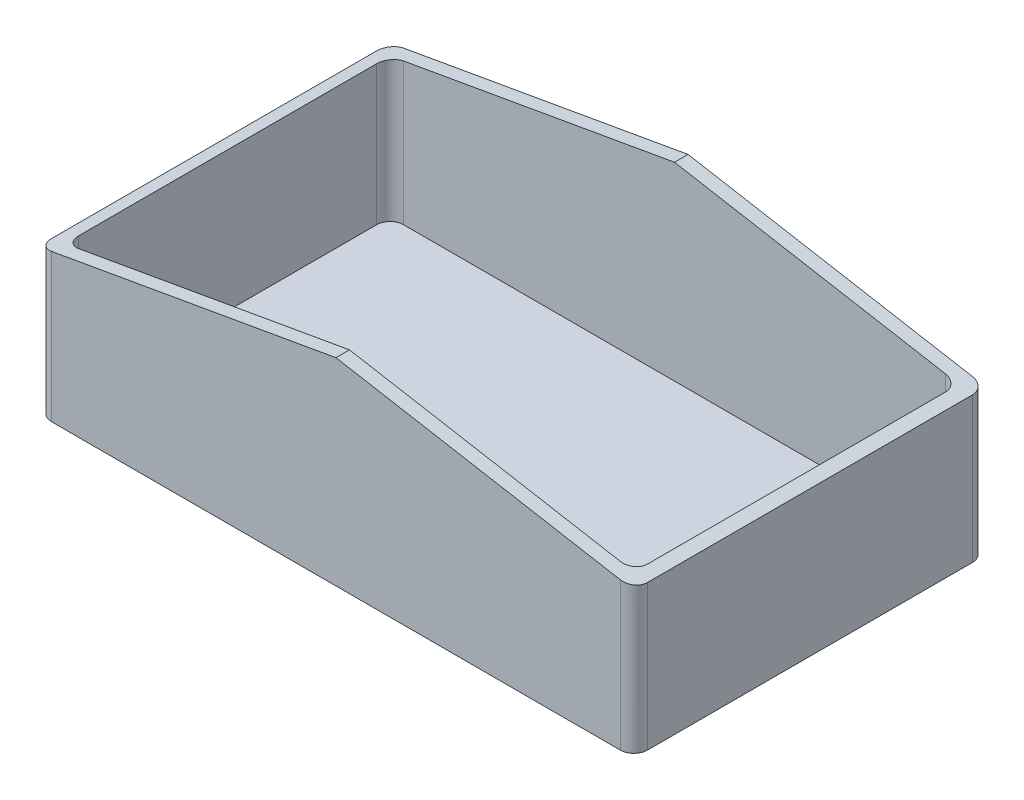
from build123d import *

# Parameters (mm, degrees)
EXTRUDE_1_DEPTH     = 30
EXTRUDE_2_DEPTH     = 700
CUT_EXTRUDE_1_REACH = 1854.809


with BuildPart() as part:
    # Эскиз1 → Бобышка-Вытянуть1 (new body)
    with BuildSketch(Plane(origin=(0, 0, 0), x_dir=(1, 0, 0), z_dir=(0, 1, 0))):
        with BuildLine():
            Line((-1050, -650), (1050, -650))
            ThreePointArc((1050, -650), (1085.355339059, -635.355339059), (1100, -600))
            Line((1100, -600), (1100, 600))
            ThreePointArc((1100, 600), (1085.355339059, 635.355339059), (1050, 650))
            Line((1050, 650), (-1050, 650))
            ThreePointArc((-1050, 650), (-1085.355339059, 635.355339059), (-1100, 600))
            Line((-1100, 600), (-1100, -600))
            ThreePointArc((-1100, -600), (-1085.355339059, -635.355339059), (-1050, -650))
        make_face()
    extrude(amount=EXTRUDE_1_DEPTH)

    # Эскиз2 → Бобышка-Вытянуть2 (add)
    with BuildSketch(Plane(origin=(0, 30, 0), x_dir=(1, 0, 0), z_dir=(0, 1, 0))):
        with BuildLine():
            Line((-1050, -650), (1050, -650))
            ThreePointArc((1050, -650), (1085.355339059, -635.355339059), (1100, -600))
            Line((1100, -600), (1100, 600))
            ThreePointArc((1100, 600), (1085.355339059, 635.355339059), (1050, 650))
            Line((1050, 650), (-1050, 650))
            ThreePointArc((-1050, 650), (-1085.355339059, 635.355339059), (-1100, 600))
            Line((-1100, 600), (-1100, -600))
            ThreePointArc((-1100, -600), (-1085.355339059, -635.355339059), (-1050, -650))
        make_face()
        with BuildLine():
            Line((-1000, -600), (1000, -600))
            ThreePointArc((1000, -600), (1035.355339059, -585.355339059), (1050, -550))
            Line((1050, -550), (1050, 550))
            ThreePointArc((1050, 550), (1035.355339059, 585.355339059), (1000, 600))
            Line((1000, 600), (-1000, 600))
            ThreePointArc((-1000, 600), (-1035.355339059, 585.355339059), (-1050, 550))
            Line((-1050, 550), (-1050, -550))
            ThreePointArc((-1050, -550), (-1035.355339059, -585.355339059), (-1000, -600))
        make_face(mode=Mode.SUBTRACT)
    extrude(amount=EXTRUDE_2_DEPTH)

    # Эскиз3 → Вырез-Вытянуть1 (cut, up to next)
    with BuildSketch(Plane.XY.offset(650), mode=Mode.PRIVATE) as cut_extrude_1_sk1:
        Polygon((0, 730), (1300, 500.774925079), (1300, 730), (-1300, 730), (-1300, 500.774925079), align=None)
    cut_extrude_1_tool1 = extrude(cut_extrude_1_sk1.sketch, amount=-CUT_EXTRUDE_1_REACH, mode=Mode.PRIVATE) & part.part
    add(cut_extrude_1_tool1.solids().sort_by_distance((654.532365, 641.091783, 650))[0], mode=Mode.SUBTRACT)
    add(cut_extrude_1_tool1.solids().sort_by_distance((654.532365, 641.091783, 650))[1], mode=Mode.SUBTRACT)


solid = part.part
